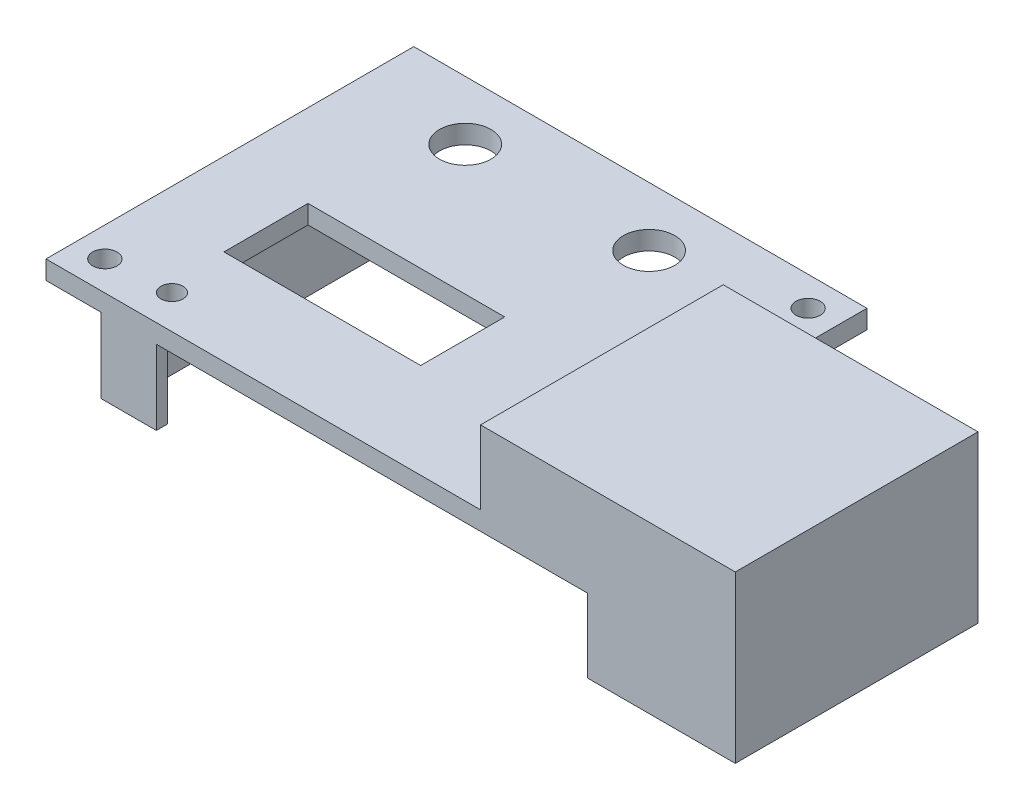
from build123d import *

# Parameters (mm, degrees)
SKETCH1_W           = 61.618
SKETCH1_H           = 50
SKETCH1_R           = 3.5
SKETCH1_R_2         = 1
SKETCH1_W_2         = 30.0482
SKETCH1_H_2         = 11.43
BOSS_EXTRUDE1_DEPTH = 2.54
BOSS_EXTRUDE2_DEPTH = 10.16
BOSS_EXTRUDE3_START = -32
BOSS_EXTRUDE3_DEPTH = 32
SKETCH5_W           = 29.558
SKETCH5_H           = 10
BOSS_EXTRUDE4_DEPTH = 2
SKETCH9_W           = 8.561459742
SKETCH9_H           = 33.54
CUT_EXTRUDE1_DEPTH  = 10.16
SKETCH10_R          = 1.65
SKETCH10_R_2        = 1.5
CUT_EXTRUDE2_DEPTH  = 107.976533202
BOSS_EXTRUDE7_DEPTH = 10
SKETCH12_R          = 4
BOSS_EXTRUDE8_DEPTH = 1
SKETCH13_W          = 12
SKETCH13_H          = 10
CUT_EXTRUDE3_DEPTH  = 10
SKETCH14_W          = 3.302
SKETCH14_H          = 11.43
BOSS_EXTRUDE9_DEPTH = 2.54


with BuildPart() as part:
    # Sketch1 → Boss-Extrude1 (new body)
    with BuildSketch(Plane(origin=(0, 0, 0), x_dir=(1, 0, 0), z_dir=(0, 1, 0))):
        with Locations((30.809, 25)):
            Rectangle(SKETCH1_W, SKETCH1_H)
        with Locations(Location((15, 42, 0), (0, 0, 270))):
            Circle(SKETCH1_R, mode=Mode.SUBTRACT)
        with Locations(Location((40, 42, 0), (0, 0, 270))):
            Circle(SKETCH1_R, mode=Mode.SUBTRACT)
        with Locations(Location((12.524, 4.6002, 0), (0, 0, 270))):
            Circle(SKETCH1_R_2, mode=Mode.SUBTRACT)
        with Locations((26.2941, 18.637)):
            Rectangle(SKETCH1_W_2, SKETCH1_H_2, mode=Mode.SUBTRACT)
    extrude(amount=BOSS_EXTRUDE1_DEPTH)

    # Sketch3 → Boss-Extrude2 (add)
    with BuildSketch(Plane.XZ):
        Polygon((10, -32), (10, -2), (15, -2), (15, 0), (7.46, 0), (7.46, -34.54), (10, -34.54), align=None)
    extrude(amount=BOSS_EXTRUDE2_DEPTH)

    # Sketch4 → Boss-Extrude3 (add)
    with BuildSketch(Plane.XY.offset(BOSS_EXTRUDE3_START)):
        Polygon((59.078, 0), (59.078, 12.54), (93.716, 12.54), (93.716, 0), (91.176, 0), (91.176, 10), (61.618, 10), (61.618, 0), align=None)
    extrude(amount=BOSS_EXTRUDE3_DEPTH)

    # Sketch5 → Boss-Extrude4 (add)
    with BuildSketch(Plane.XY):
        with Locations((76.397, 5)):
            Rectangle(SKETCH5_W, SKETCH5_H)
    extrude(amount=-BOSS_EXTRUDE4_DEPTH)

    # Sketch9 → Cut-Extrude1 (cut)
    with BuildSketch(Plane.XZ.offset(10.16)):
        with Locations((13.780729871, -18.27)):
            Rectangle(SKETCH9_W, SKETCH9_H)
    extrude(amount=-CUT_EXTRUDE1_DEPTH, mode=Mode.SUBTRACT)

    # Sketch10 → Cut-Extrude2 (cut, through all)
    with BuildSketch(Plane(origin=(0, 2.54, 0), x_dir=(1, 0, 0), z_dir=(0, 1, 0))):
        with Locations(Location((57.618, 46, 0), (0, 0, 270))):
            Circle(SKETCH10_R)
        with Locations(Location((4, 4, 0), (0, 0, 270))):
            Circle(SKETCH10_R)
        with Locations(Location((12.524, 4.6002, 0), (0, 0, 270))):
            Circle(SKETCH10_R_2)
    extrude(amount=-CUT_EXTRUDE2_DEPTH, mode=Mode.SUBTRACT)

    # Sketch11 → Boss-Extrude7 (add)
    with BuildSketch(Plane.XZ):
        Polygon((91.176, -32), (93.716, -32), (93.716, 0), (61.618, 0), (61.618, -2), (91.176, -2), align=None)
    extrude(amount=BOSS_EXTRUDE7_DEPTH)

    # Sketch12 → Boss-Extrude8 (add)
    with BuildSketch(Plane(origin=(0, 0, -32), x_dir=(-1, 0, 0), z_dir=(0, 0, -1))):
        Polygon((-59.078, 2.54), (-61.618, 2.54), (-61.618, -10), (-93.716, -10), (-93.716, 12.54), (-59.078, 12.54), align=None)
        with Locations((-85.4356, 4.031)):
            Circle(SKETCH12_R, mode=Mode.SUBTRACT)
    extrude(amount=BOSS_EXTRUDE8_DEPTH)

    # Sketch13 → Cut-Extrude3 (cut)
    with BuildSketch(Plane.XY):
        with Locations((67.618, -5)):
            Rectangle(SKETCH13_W, SKETCH13_H)
    extrude(amount=-CUT_EXTRUDE3_DEPTH, mode=Mode.SUBTRACT)

    # Sketch14 → Boss-Extrude9 (add)
    with BuildSketch(Plane(origin=(0, 2.54, 0), x_dir=(1, 0, 0), z_dir=(0, 1, 0))):
        with Locations((39.6672, 18.637)):
            Rectangle(SKETCH14_W, SKETCH14_H)
    extrude(amount=-BOSS_EXTRUDE9_DEPTH)


solid = part.part
